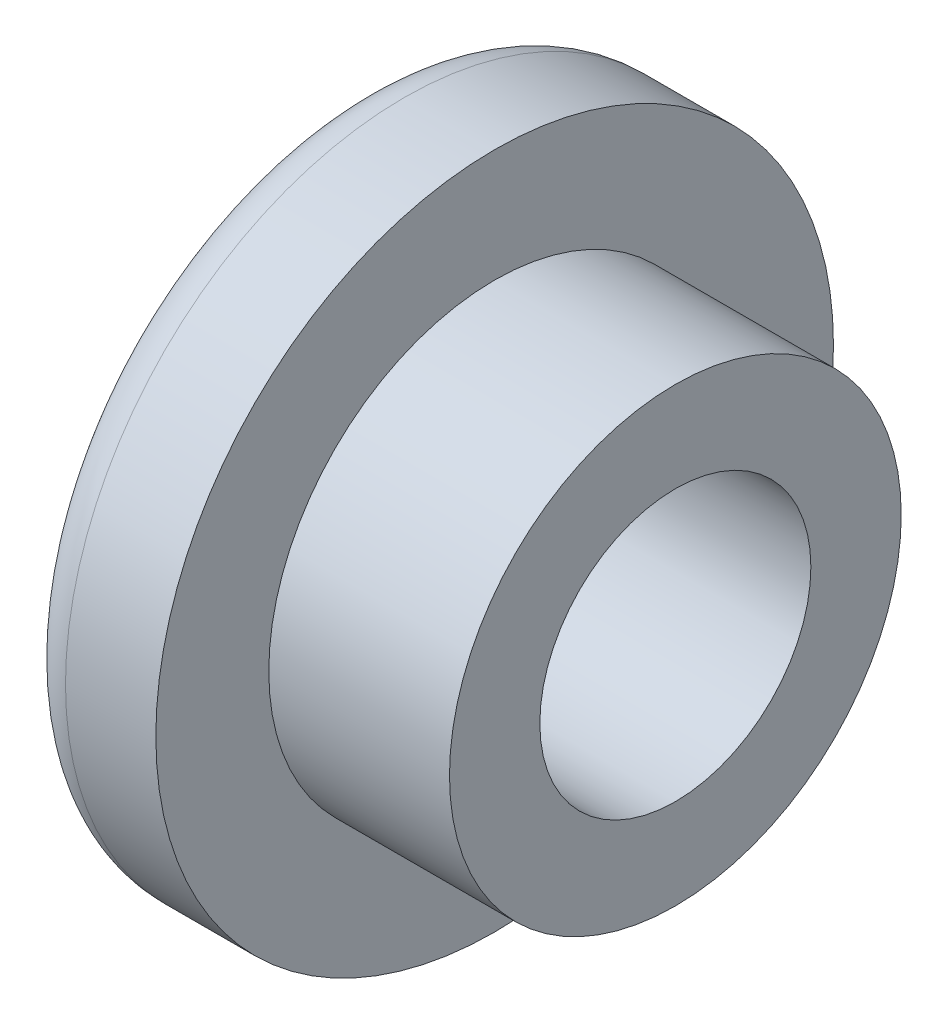
from build123d import *

# Parameters (mm, degrees)
SKETCH2_R               = 5
BOSS_EXTRUDE1_DEPTH     = 4
CUT_EXTRUDE1_DEPTH      = 19.172781887
CUT_EXTRUDE1_DEPTH_BACK = 19.172781887
SKETCH3_R               = 3


with BuildPart() as part:
    # Sketch1 → Revolve1 (revolve)
    with BuildSketch(Plane.XY, mode=Mode.PRIVATE) as revolve1_sk:
        with BuildLine():
            Line((1, 0), (3, 0))
            Line((3, 0), (3, 7.5))
            Line((3, 7.5), (0, 7.5))
            Line((0, 7.5), (0, 1))
            ThreePointArc((0, 1), (0.292893219, 0.292893219), (1, 0))
        make_face()
    revolve(revolve1_sk.sketch.rotate(Axis((0, 7.5, 0), (1, 0, 0)), 270), axis=Axis((0, 7.5, 0), (1, 0, 0)))

    # Sketch2 → Boss-Extrude1 (add)
    with BuildSketch(Plane(origin=(3, 0, 0), x_dir=(0, 0, -1), z_dir=(1, 0, 0))):
        with Locations((0, 7.5)):
            Circle(SKETCH2_R)
    extrude(amount=BOSS_EXTRUDE1_DEPTH)

    # Sketch3 → Cut-Extrude1 (cut, two sides: drawn at the far end of the back side and taken through both)
    with BuildSketch(Plane.ZY.offset(-CUT_EXTRUDE1_DEPTH_BACK)):
        with Locations((0, 7.5)):
            Circle(SKETCH3_R)
    extrude(amount=CUT_EXTRUDE1_DEPTH + CUT_EXTRUDE1_DEPTH_BACK, mode=Mode.SUBTRACT)


solid = part.part
